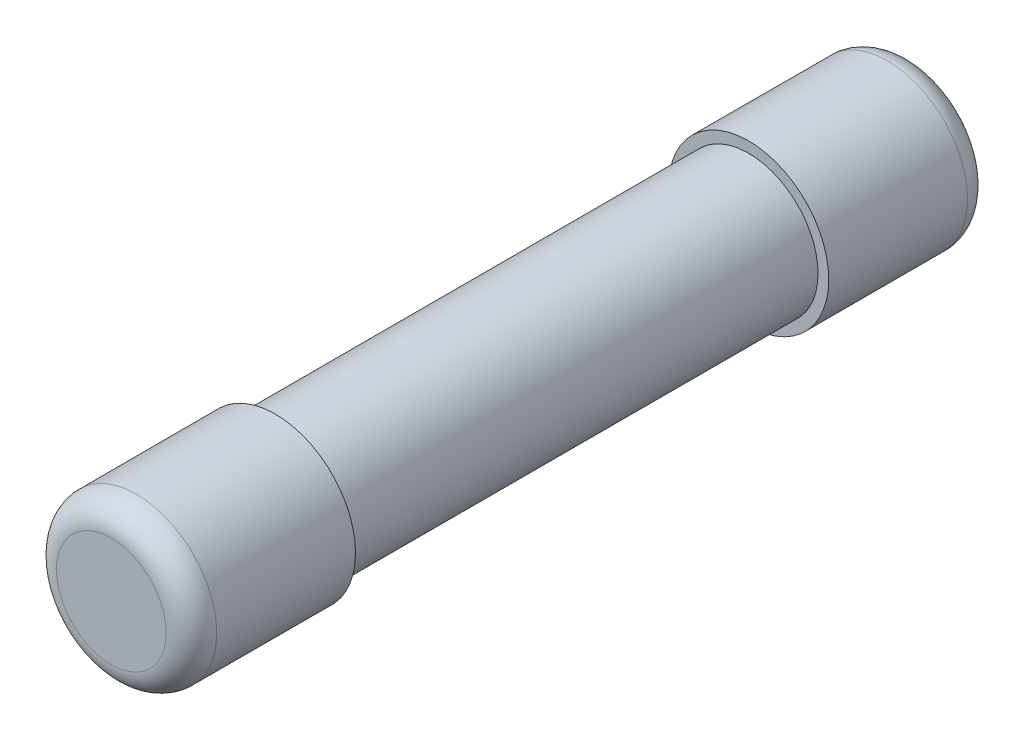
from build123d import *

# Parameters (mm, degrees)
SKETCH3_W = 29.6878375
SKETCH3_H = 1.03108125
FILLET1_R = 1


with BuildPart() as part:
    # Sketch3 → Revolve1 (revolve)
    with BuildSketch(Plane(origin=(0, 0, 0), x_dir=(0, 0, -1), z_dir=(1, 0, 0)), mode=Mode.PRIVATE) as revolve1_sk:
        with Locations((0, 2.234009375)):
            Rectangle(SKETCH3_W, SKETCH3_H)
    revolve(revolve1_sk.sketch.rotate(Axis((0, 0, 15.875), (0, 0, -1)), 90), axis=Axis((0, 0, 15.875), (0, 0, -1)))


with BuildPart() as body_2:
    # Sketch4 → Revolve2 (revolve)
    with BuildSketch(Plane(origin=(0, 0, 0), x_dir=(0, 0, -1), z_dir=(1, 0, 0)), mode=Mode.PRIVATE) as revolve2_sk:
        Polygon((-9.375775, 2.74955), (-9.375775, 3.175), (-15.875, 3.175), (-15.875, 0), (-14.84391875, 0), (-14.84391875, 2.74955), align=None)
    revolve(revolve2_sk.sketch.rotate(Axis((0, 0, 15.875), (0, 0, -1)), 90), axis=Axis((0, 0, 15.875), (0, 0, -1)))

    # Fillet1
    fillet1_edges = [body_2.edges().sort_by_distance(p)[0] for p in [
        (-3.175, 0, 15.875),
    ]]
    fillet(fillet1_edges, radius=FILLET1_R)


with BuildPart() as body_3:
    # Mirror1: mirrored copy
    add(body_2.part.mirror(Plane.XY))


solid = Compound([part.part, body_2.part, body_3.part])
